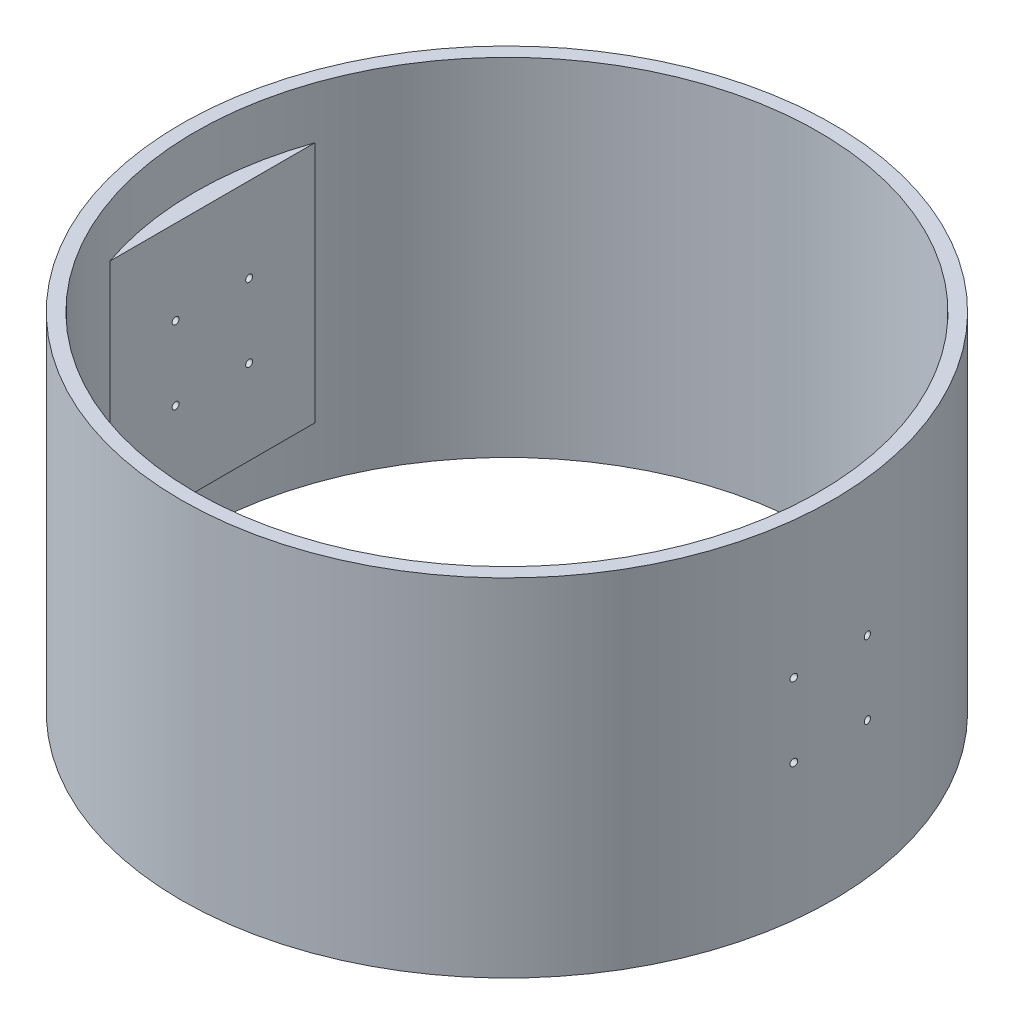
from build123d import *
from build123d.topology import SkipClean

# Parameters (mm, degrees)
SKETCH1_R                            = 94
SKETCH1_R_2                          = 90
BOSS_EXTRUDE1_DEPTH                  = 50
BOSS_EXTRUDE2_REACH                  = 144.028
BOSS_EXTRUDE2_END_RADIUS             = 90
SKETCH2_W                            = 70
SKETCH2_H                            = 70
BOSS_EXTRUDE2_DIRECTION_2_REACH      = 144.028
BOSS_EXTRUDE2_DIRECTION_2_END_RADIUS = 90
CUT_EXTRUDE1_DEPTH                   = 143.028166221
CUT_EXTRUDE1_DEPTH_BACK              = 143.028166221
CUT_EXTRUDE3_DEPTH                   = 143.028166221
CUT_EXTRUDE3_DEPTH_BACK              = 143.028166221
SKETCH2_3_R                          = 1


with BuildPart() as part:
    # Sketch1 → Boss-Extrude1 (new, symmetric)
    with BuildSketch(Plane(origin=(0, 0, 0), x_dir=(1, 0, 0), z_dir=(0, 1, 0))):
        Circle(SKETCH1_R)
        Circle(SKETCH1_R_2, mode=Mode.SUBTRACT)
    extrude(amount=BOSS_EXTRUDE1_DEPTH, both=True)

    # Boss-Extrude2: up to this cylinder (the profile starts inside it)
    boss_extrude2_end = Plane(origin=(0, 0, 0), z_dir=(0, -1, 0)) * Cylinder(BOSS_EXTRUDE2_END_RADIUS, 469.056, mode=Mode.PRIVATE)
    # Sketch2 → Boss-Extrude2 (add, up to the surface)
    with BuildSketch(Plane(origin=(0, 0, 0), x_dir=(0, 0, -1), z_dir=(1, 0, 0)), mode=Mode.PRIVATE) as boss_extrude2_sk1:
        Rectangle(SKETCH2_W, SKETCH2_H)
    boss_extrude2_tool1 = extrude(boss_extrude2_sk1.sketch, amount=-BOSS_EXTRUDE2_REACH, mode=Mode.PRIVATE) & boss_extrude2_end
    add(boss_extrude2_tool1.solids().sort_by_distance((0, 0, 0))[0])

    # Boss-Extrude2 direction 2: up to this cylinder (the profile starts inside it)
    boss_extrude2_direction_2_end = Plane(origin=(0, 0, 0), z_dir=(0, -1, 0)) * Cylinder(BOSS_EXTRUDE2_DIRECTION_2_END_RADIUS, 469.056, mode=Mode.PRIVATE)
    # Sketch2 → Boss-Extrude2 direction 2 (add, up to the surface)
    with BuildSketch(Plane(origin=(0, 0, 0), x_dir=(0, 0, -1), z_dir=(1, 0, 0)), mode=Mode.PRIVATE) as boss_extrude2_direction_2_sk1:
        Rectangle(SKETCH2_W, SKETCH2_H)
    boss_extrude2_direction_2_tool1 = extrude(boss_extrude2_direction_2_sk1.sketch, amount=BOSS_EXTRUDE2_DIRECTION_2_REACH, mode=Mode.PRIVATE) & boss_extrude2_direction_2_end
    add(boss_extrude2_direction_2_tool1.solids().sort_by_distance((0, 0, 0))[0])

    # Sketch3 → Cut-Extrude1 (cut, two sides: drawn at the far end of the back side and taken through both)
    with SkipClean():  # the faces are left unmerged after this step: merging them gives an invalid solid
        with BuildSketch(Plane(origin=(0, 0, 0), x_dir=(1, 0, 0), z_dir=(0, 1, 0)).offset(-CUT_EXTRUDE1_DEPTH_BACK)):
            with BuildLine():
                Line((-85, 29.580398915), (-85, -29.580398915))
                ThreePointArc((-85, -29.580398915), (0, -90), (85, -29.580398915))
                Line((85, -29.580398915), (85, 29.580398915))
                ThreePointArc((85, 29.580398915), (0, 90), (-85, 29.580398915))
            make_face()
        extrude(amount=CUT_EXTRUDE1_DEPTH + CUT_EXTRUDE1_DEPTH_BACK, mode=Mode.SUBTRACT)

    # Sketch2<3> → Cut-Extrude3 (cut, two sides: drawn at the far end of the back side and taken through both)
    with SkipClean():  # the faces are left unmerged after this step: merging them gives an invalid solid
        with BuildSketch(Plane(origin=(0, 0, 0), x_dir=(0, 0, -1), z_dir=(1, 0, 0)).offset(-CUT_EXTRUDE3_DEPTH_BACK)):
            with Locations((10.606601718, 10.606601718)):
                Circle(SKETCH2_3_R)
            with Locations((-10.606601718, 10.606601718)):
                Circle(SKETCH2_3_R)
            with Locations((-10.606601718, -10.606601718)):
                Circle(SKETCH2_3_R)
            with Locations((10.606601718, -10.606601718)):
                Circle(SKETCH2_3_R)
        extrude(amount=CUT_EXTRUDE3_DEPTH + CUT_EXTRUDE3_DEPTH_BACK, mode=Mode.SUBTRACT)


solid = part.part
